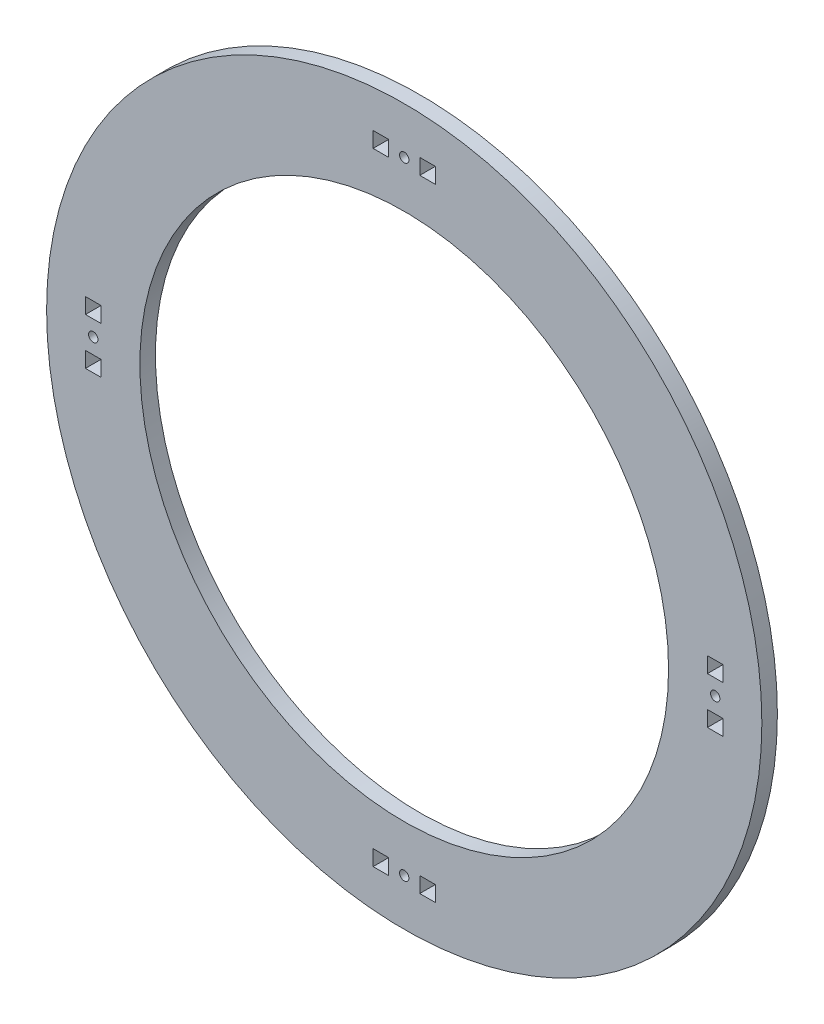
from build123d import *

# Parameters (mm, degrees)
ESQUISSE1_R        = 115
ESQUISSE1_R_2      = 85
ESQUISSE1_R_3      = 1.5
ESQUISSE1_W        = 5
ESQUISSE1_H        = 5
BOSS_EXTRU_1_DEPTH = 5


with BuildPart() as part:
    # Esquisse1 → Boss.-Extru.1 (new body)
    with BuildSketch(Plane.XY):
        Circle(ESQUISSE1_R)
        Circle(ESQUISSE1_R_2, mode=Mode.SUBTRACT)
        with Locations((-100, 0)):
            Circle(ESQUISSE1_R_3, mode=Mode.SUBTRACT)
        with Locations((0, 100)):
            Circle(ESQUISSE1_R_3, mode=Mode.SUBTRACT)
        with Locations((100, 0)):
            Circle(ESQUISSE1_R_3, mode=Mode.SUBTRACT)
        with Locations((0, -100)):
            Circle(ESQUISSE1_R_3, mode=Mode.SUBTRACT)
        with Locations((-100, -7.5)):
            Rectangle(ESQUISSE1_W, ESQUISSE1_H, mode=Mode.SUBTRACT)
        with Locations((-100, 7.5)):
            Rectangle(ESQUISSE1_W, ESQUISSE1_H, mode=Mode.SUBTRACT)
        with Locations((-7.5, 100)):
            Rectangle(ESQUISSE1_W, ESQUISSE1_H, mode=Mode.SUBTRACT)
        with Locations((7.5, 100)):
            Rectangle(ESQUISSE1_W, ESQUISSE1_H, mode=Mode.SUBTRACT)
        with Locations((100, 7.5)):
            Rectangle(ESQUISSE1_W, ESQUISSE1_H, mode=Mode.SUBTRACT)
        with Locations((100, -7.5)):
            Rectangle(ESQUISSE1_W, ESQUISSE1_H, mode=Mode.SUBTRACT)
        with Locations((7.5, -100)):
            Rectangle(ESQUISSE1_W, ESQUISSE1_H, mode=Mode.SUBTRACT)
        with Locations((-7.5, -100)):
            Rectangle(ESQUISSE1_W, ESQUISSE1_H, mode=Mode.SUBTRACT)
    extrude(amount=BOSS_EXTRU_1_DEPTH)


solid = part.part
